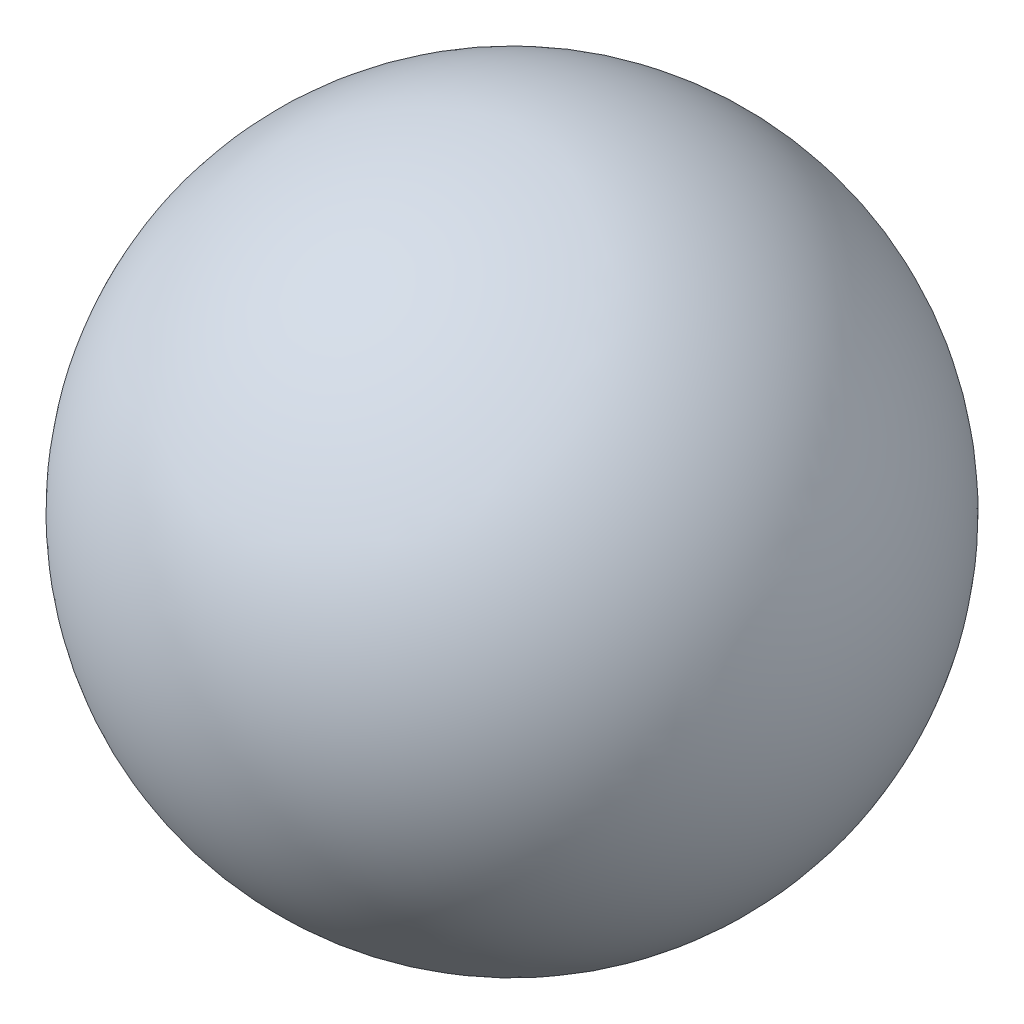
from build123d import *


with BuildPart() as part:
    # Sketch6 → Revolve5 (revolve)
    with BuildSketch(Plane(origin=(0, 0, 0), x_dir=(1, 0, 0), z_dir=(0, 1, 0))):
        with BuildLine():
            Line((-20, 0), (20, 0))
            ThreePointArc((20, 0), (0, -20), (-20, 0))
        make_face()
    revolve(axis=Axis((-20, 0, 0), (1, 0, 0)))

    # Sketch7 → Cut-Revolve16 (revolve, cut)
    with BuildSketch(Plane(origin=(0, 0, 0), x_dir=(1, 0, 0), z_dir=(0, 1, 0))):
        with BuildLine():
            Line((-19.6, 0), (19.6, 0))
            ThreePointArc((19.6, 0), (0, -19.6), (-19.6, 0))
        make_face()
    revolve(axis=Axis((0, 0, 0), (-1, 0, 0)), mode=Mode.SUBTRACT)


solid = part.part
